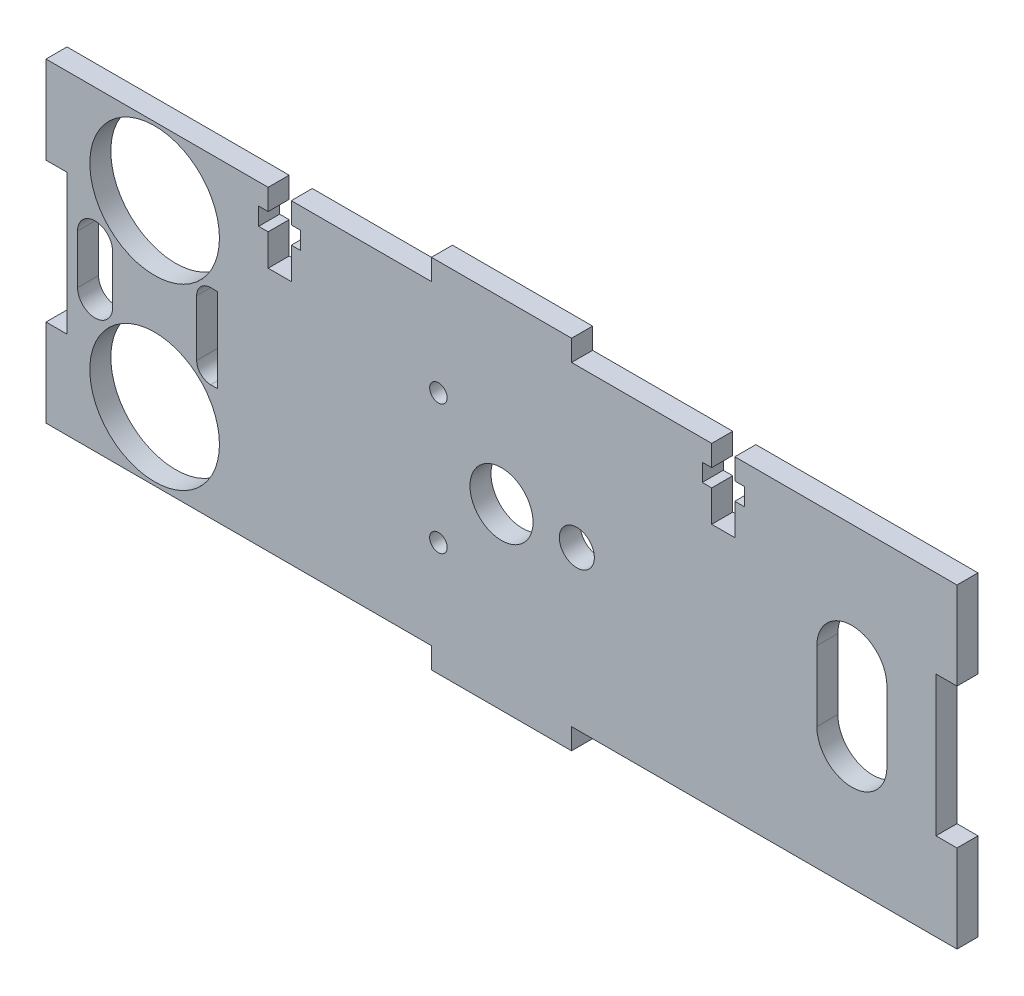
from build123d import *

# Parameters (mm, degrees)
SKETCH1_R           = 9.25
SKETCH1_R_2         = 4.5
SKETCH1_R_3         = 2.5
SKETCH1_R_4         = 1.25
BOSS_EXTRUDE1_DEPTH = 3


with BuildPart() as part:
    # Sketch1 → Boss-Extrude1 (new body)
    with BuildSketch(Plane.XY):
        Polygon((-10, -22.5), (-65, -22.5), (-65, -10), (-62, -10), (-62, 10), (-65, 10), (-65, 22.5), (-33.3, 22.5), (-33.3, 19.5), (-34.65, 19.5), (-34.65, 17), (-33.3, 17), (-33.3, 12.5), (-30, 12.5), (-30, 17), (-28.65, 17), (-28.65, 19.5), (-30, 19.5), (-30, 22.5), (-10, 22.5), (-10, 25.5), (10, 25.5), (10, 22.5), (30, 22.5), (30, 19.5), (28.65, 19.5), (28.65, 17), (30, 17), (30, 12.5), (33.3, 12.5), (33.3, 17), (34.65, 17), (34.65, 19.5), (33.3, 19.5), (33.3, 22.5), (65, 22.5), (65, 10), (62, 10), (62, -10), (65, -10), (65, -22.5), (10, -22.5), (10, -25.5), (-10, -25.5), align=None)
        with Locations((-49.5, 12.75)):
            Circle(SKETCH1_R, mode=Mode.SUBTRACT)
        with Locations((-49.5, -12.75)):
            Circle(SKETCH1_R, mode=Mode.SUBTRACT)
        Circle(SKETCH1_R_2, mode=Mode.SUBTRACT)
        with Locations((10.75, 0)):
            Circle(SKETCH1_R_3, mode=Mode.SUBTRACT)
        with Locations((-9, 9.25)):
            Circle(SKETCH1_R_4, mode=Mode.SUBTRACT)
        with Locations(Location((-9, -9.25, 0), (0, 0, 180))):
            Circle(SKETCH1_R_4, mode=Mode.SUBTRACT)
        with BuildLine():
            Line((-55.5, 3.5), (-55.5, -3.5))
            ThreePointArc((-55.5, -3.5), (-58, -6), (-60.5, -3.5))
            Line((-60.5, -3.5), (-60.5, 3.5))
            ThreePointArc((-60.5, 3.5), (-58, 6), (-55.5, 3.5))
        make_face(mode=Mode.SUBTRACT)
        with BuildLine():
            Line((-40.5, -6), (-41.5, -6))
            ThreePointArc((-41.5, -6), (-42.914213562, -5.414213562), (-43.5, -4))
            Line((-43.5, -4), (-43.5, 4))
            ThreePointArc((-43.5, 4), (-42.914213562, 5.414213562), (-41.5, 6))
            Line((-41.5, 6), (-40.5, 6))
            Line((-40.5, 6), (-40.5, -6))
        make_face(mode=Mode.SUBTRACT)
        with BuildLine():
            Line((45, -5), (45, 5))
            ThreePointArc((45, 5), (50, 10), (55, 5))
            Line((55, 5), (55, -5))
            ThreePointArc((55, -5), (50, -10), (45, -5))
        make_face(mode=Mode.SUBTRACT)
    extrude(amount=BOSS_EXTRUDE1_DEPTH)


solid = part.part
